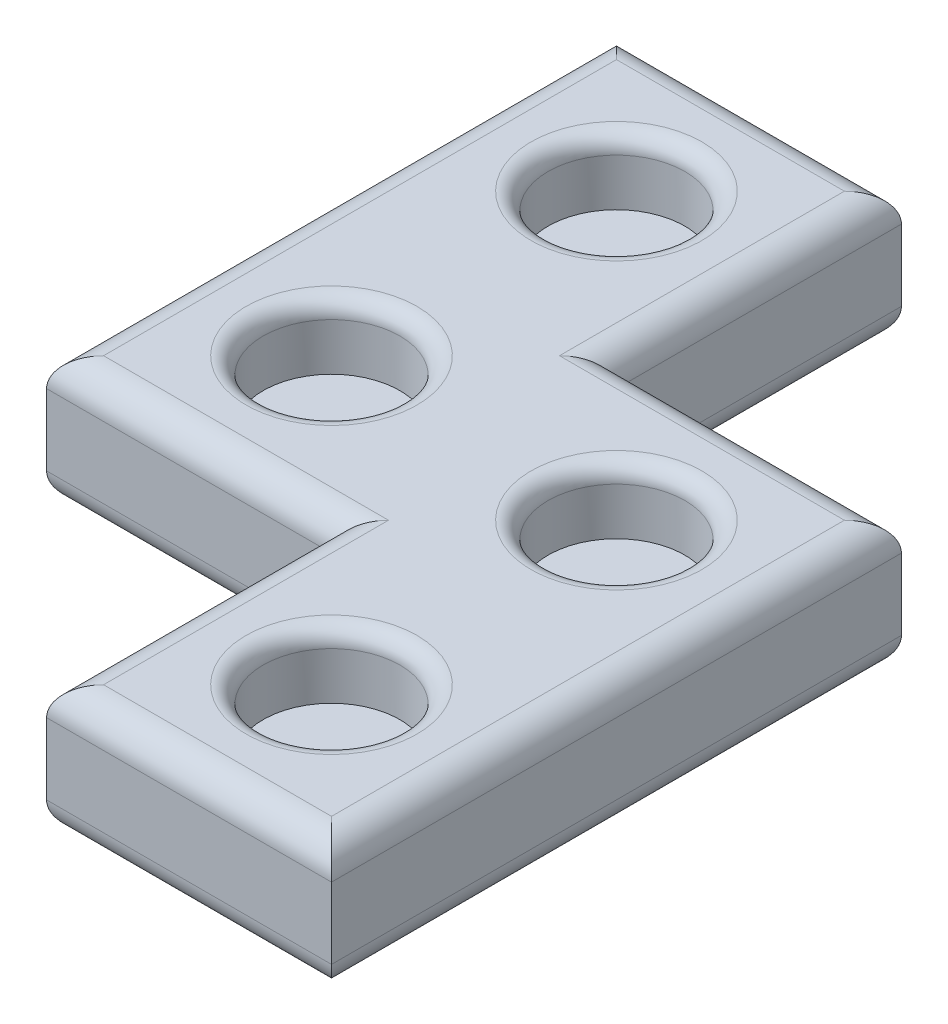
from build123d import *

# Parameters (mm, degrees)
BOSS_EXTRUDE2_DEPTH = 5.715
SKETCH2_R           = 3.048
CUT_EXTRUDE1_DEPTH  = 2.8702
FILLET1_R           = 1.27
FILLET2_R           = 1.27
FILLET3_R           = 0.762


with BuildPart() as part:
    # Sketch1 → Boss-Extrude2 (new body)
    with BuildSketch(Plane(origin=(0, 0, 0), x_dir=(1, 0, 0), z_dir=(0, 1, 0))):
        Polygon((-12.7, 15.59701387), (0, 15.59701387), (0, 2.89701387), (12.7, 2.89701387), (12.7, -22.50298613), (0, -22.50298613), (0, -9.80298613), (-12.7, -9.80298613), align=None)
    extrude(amount=BOSS_EXTRUDE2_DEPTH)

    # Sketch2 → Cut-Extrude1 (cut)
    with BuildSketch(Plane(origin=(0, 5.715, 0), x_dir=(1, 0, 0), z_dir=(0, 1, 0))):
        with Locations(Location((-6.35, 9.24701387, 0), (0, 0, 270))):
            Circle(SKETCH2_R)
        with Locations(Location((6.35, -16.15298613, 0), (0, 0, 270))):
            Circle(SKETCH2_R)
        with Locations(Location((-6.35, -3.45298613, 0), (0, 0, 270))):
            Circle(SKETCH2_R)
        with Locations(Location((6.35, -3.45298613, 0), (0, 0, 270))):
            Circle(SKETCH2_R)
    extrude(amount=-CUT_EXTRUDE1_DEPTH, mode=Mode.SUBTRACT)

    # Fillet1
    fillet1_edges = [part.edges().sort_by_distance(p)[0] for p in [
        (-6.35, 5.715, -15.59701387),
        (0, 5.715, -9.24701387),
        (6.35, 5.715, -2.89701387),
        (12.7, 5.715, 9.80298613),
        (6.35, 5.715, 22.50298613),
        (0, 5.715, 16.15298613),
        (-6.35, 5.715, 9.80298613),
        (-12.7, 5.715, -2.89701387),
    ]]
    fillet(fillet1_edges, radius=FILLET1_R)

    # Fillet2
    fillet2_edges = [part.edges().sort_by_distance(p)[0] for p in [
        (-12.7, 0, -2.89701387),
        (-6.35, 0, 9.80298613),
        (0, 0, 16.15298613),
        (6.35, 0, 22.50298613),
        (12.7, 0, 9.80298613),
        (6.35, 0, -2.89701387),
        (0, 0, -9.24701387),
        (-6.35, 0, -15.59701387),
    ]]
    fillet(fillet2_edges, radius=FILLET2_R)

    # Fillet3
    fillet3_edges = [part.edges().sort_by_distance(p)[0] for p in [
        (-6.35, 5.715, -12.29501387),
        (6.35, 5.715, 0.40498613),
        (-6.35, 5.715, 0.40498613),
        (6.35, 5.715, 13.10498613),
    ]]
    fillet(fillet3_edges, radius=FILLET3_R)


solid = part.part
